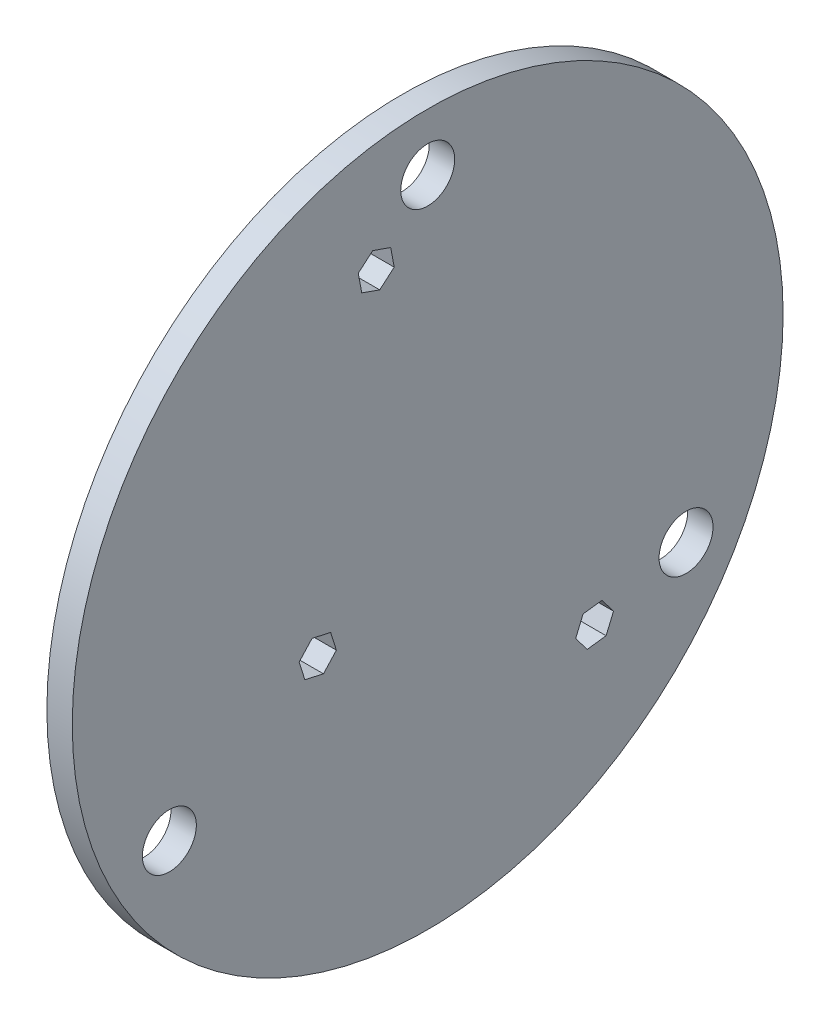
from build123d import *

# Parameters (mm, degrees)
SKETCH1_R           = 56
BOSS_EXTRUDE1_DEPTH = 4
SKETCH2_R           = 4.25
CUT_EXTRUDE1_DEPTH  = 80.296910406
CUT_EXTRUDE3_DEPTH  = 80.296910406


with BuildPart() as part:
    # Sketch1 → Boss-Extrude1 (new body)
    with BuildSketch(Plane(origin=(0, 0, 0), x_dir=(0, 0, -1), z_dir=(1, 0, 0))):
        Circle(SKETCH1_R)
    extrude(amount=BOSS_EXTRUDE1_DEPTH)

    # Sketch2 → Cut-Extrude1 (cut, through all)
    with BuildSketch(Plane.ZY):
        with Locations((0, 47)):
            Circle(SKETCH2_R)
        with Locations((40.703193978, -23.5)):
            Circle(SKETCH2_R)
        with Locations((-40.703193978, -23.5)):
            Circle(SKETCH2_R)
    extrude(amount=-CUT_EXTRUDE1_DEPTH, mode=Mode.SUBTRACT)

    # Sketch4 → Cut-Extrude3 (cut, through all)
    with BuildSketch(Plane(origin=(4, 0, 0), x_dir=(0, 0, -1), z_dir=(1, 0, 0))):
        Polygon((27.459399078, -24.776044357), (24.480611991, -25.150424944), (23.315441547, -27.917320527), (25.12905819, -30.309835523), (28.107845277, -29.935454936), (29.273015721, -27.168559353), align=None)
        Polygon((-10.388823518, 36.091072444), (-7.5578925, 35.09149108), (-5.276764136, 37.043358576), (-5.826566791, 39.994807436), (-8.65749781, 40.9943888), (-10.938626173, 39.042521304), align=None)
        Polygon((-16.424465574, -12.86538674), (-14.390989116, -10.6566978), (-15.287031618, -7.791311061), (-18.216550578, -7.13461326), (-20.250027035, -9.3433022), (-19.353984533, -12.208688939), align=None)
    extrude(amount=-CUT_EXTRUDE3_DEPTH, mode=Mode.SUBTRACT)


solid = part.part
